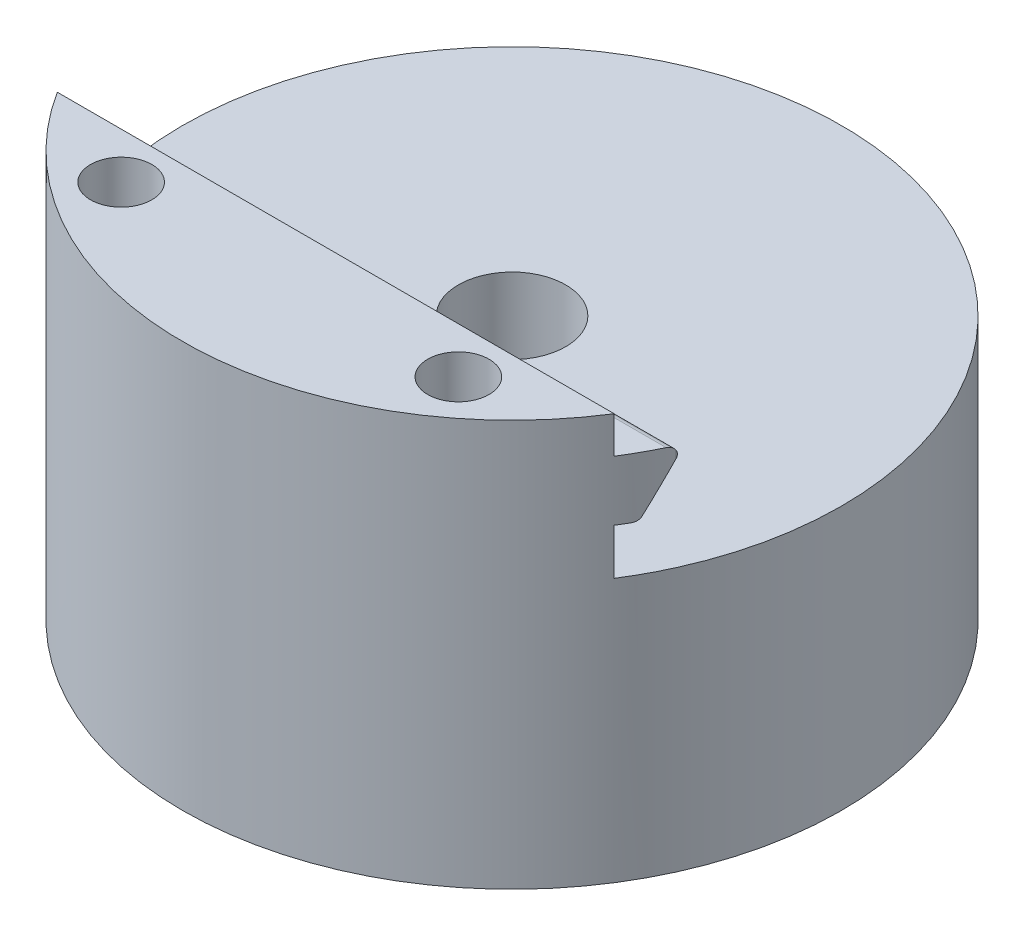
from build123d import *

# Parameters (mm, degrees)
SKETCH_1_R                             = 21.5
EXTRUDE_1_DEPTH                        = 26.5
SKETCH_2_R                             = 3.5
CUT_EXTRUDE_1_DEPTH                    = 32
CUT_EXTRUDE_2_DEPTH                    = 34
CUT_EXTRUDE_2_DEPTH_BACK               = 32
FILLET_1_R                             = 0.5
SKETCH_4_R                             = 2
CUT_EXTRUDE_3_DEPTH                    = 5
HOLE_WIZARD_M3_1_D                     = 2.5
HOLE_WIZARD_M3_1_CSINK_D               = 3.05
HOLE_WIZARD_M3_1_CSINK_ANGLE           = 90
HOLE_WIZARD_M3_1_ON_FACE_2_D           = 2.5
HOLE_WIZARD_M3_1_ON_FACE_2_CSINK_D     = 3.05
HOLE_WIZARD_M3_1_ON_FACE_2_CSINK_ANGLE = 90


with BuildPart() as part:
    # 草图1 → 凸台-拉伸1 (new body)
    with BuildSketch(Plane(origin=(0, 0, 0), x_dir=(1, 0, 0), z_dir=(0, 1, 0))):
        with Locations(Location((0, 0, 0), (0, 0, 270))):
            Circle(SKETCH_1_R)
    extrude(amount=EXTRUDE_1_DEPTH)

    # 草图2 → 切除-拉伸1 (cut)
    with BuildSketch(Plane(origin=(0, 26.5, 0), x_dir=(1, 0, 0), z_dir=(0, 1, 0))):
        with Locations(Location((0, 0, 0), (0, 0, 270))):
            Circle(SKETCH_2_R)
    extrude(amount=-CUT_EXTRUDE_1_DEPTH, mode=Mode.SUBTRACT)

    # 草图3 → 切除-拉伸2 (cut, two sides: drawn at the far end of the back side and taken through both)
    with BuildSketch(Plane(origin=(0, 0, 0), x_dir=(0, 0, -1), z_dir=(1, 0, 0)).offset(-CUT_EXTRUDE_2_DEPTH_BACK)):
        Polygon((21.5, 17.2), (-11.5, 17.2), (-11.5, 20.2), (-10.5, 20.2), (-8.5, 24.1), (-11.5, 24.1), (-11.5, 26.5), (21.5, 26.5), align=None)
    extrude(amount=CUT_EXTRUDE_2_DEPTH + CUT_EXTRUDE_2_DEPTH_BACK, mode=Mode.SUBTRACT)

    # 圆角1
    fillet_1_edges = [part.edges().sort_by_distance(p)[0] for p in [
        (0, 20.2, 10.5),
        (0, 24.1, 8.5),
    ]]
    fillet(fillet_1_edges, radius=FILLET_1_R)

    # 草图4 → 切除-拉伸3 (cut)
    with BuildSketch(Plane(origin=(0, 26.5, 0), x_dir=(1, 0, 0), z_dir=(0, 1, 0))):
        with Locations(Location((11, -14.5, 0), (0, 0, 270))):
            Circle(SKETCH_4_R)
        with Locations(Location((-11, -14.5, 0), (0, 0, 90))):
            Circle(SKETCH_4_R)
    extrude(amount=-CUT_EXTRUDE_3_DEPTH, mode=Mode.SUBTRACT)

    # M3 螺纹孔1 (through all)
    with Locations(Plane(origin=(-11, 21.5, 14.5), x_dir=(0, 0, 1), z_dir=(0, 1, 0))):
        with Locations((0, 0)):
            CounterSinkHole(HOLE_WIZARD_M3_1_D / 2, HOLE_WIZARD_M3_1_CSINK_D / 2, counter_sink_angle=HOLE_WIZARD_M3_1_CSINK_ANGLE)

    # M3 螺纹孔1 on face 2 (through all)
    with Locations(Plane(origin=(11, 26.5, 14.5), x_dir=(0, 0, 1), z_dir=(0, 1, 0))):
        with Locations((0, 0)):
            CounterSinkHole(HOLE_WIZARD_M3_1_ON_FACE_2_D / 2, HOLE_WIZARD_M3_1_ON_FACE_2_CSINK_D / 2, counter_sink_angle=HOLE_WIZARD_M3_1_ON_FACE_2_CSINK_ANGLE)


solid = part.part
